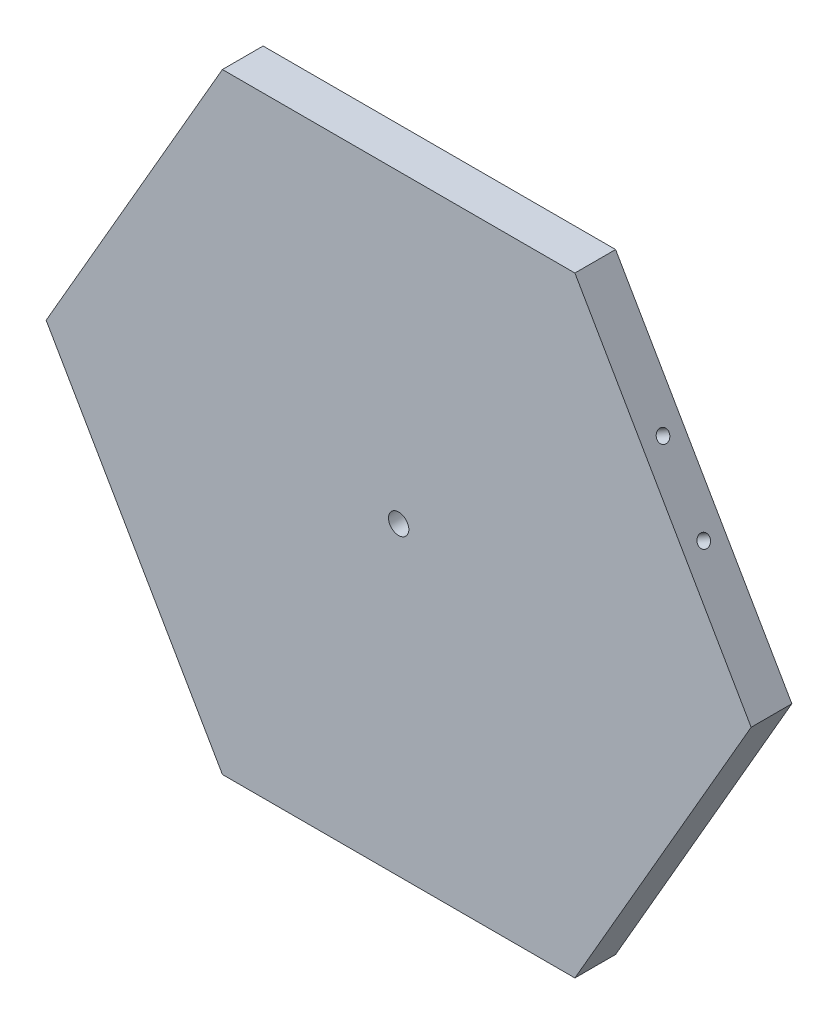
from build123d import *

# Parameters (mm, degrees)
BOSS_EXTRUDE1_DEPTH = 5
SKETCH2_R           = 1.5
CUT_EXTRUDE1_DEPTH  = 10
SKETCH3_R           = 2.5
CUT_EXTRUDE2_DEPTH  = 10
CIRPATTERN1_COUNT   = 3


with BuildPart() as part:
    # Sketch1 → Boss-Extrude1 (new, symmetric)
    with BuildSketch(Plane.XY):
        Polygon((86.602540378, 0), (43.301270189, 75), (-43.301270189, 75), (-86.602540378, 0), (-43.301270189, -75), (43.301270189, -75), align=None)
    extrude(amount=BOSS_EXTRUDE1_DEPTH, both=True)

    # Sketch2 → Cut-Extrude1 (cut)
    with BuildSketch(Plane.XZ.offset(75)):
        with Locations(Location((-10, 0, 0), (0, 0, 270))):
            Circle(SKETCH2_R)
        with Locations(Location((10, 0, 0), (0, 0, 270))):
            Circle(SKETCH2_R)
    cut_extrude1 = extrude(amount=-CUT_EXTRUDE1_DEPTH, mode=Mode.SUBTRACT)

    # Sketch3 → Cut-Extrude2 (cut)
    with BuildSketch(Plane.XY.offset(5)):
        Circle(SKETCH3_R)
    extrude(amount=-CUT_EXTRUDE2_DEPTH, mode=Mode.SUBTRACT)

    # CirPattern1: Cut-Extrude1 ×3 about axis
    cirpattern1_axis = Axis((0, 0, 0), (0, 0, 1))
    for i in range(1, CIRPATTERN1_COUNT):
        add(cut_extrude1.rotate(cirpattern1_axis, i * 360 / CIRPATTERN1_COUNT), mode=Mode.SUBTRACT)


solid = part.part
